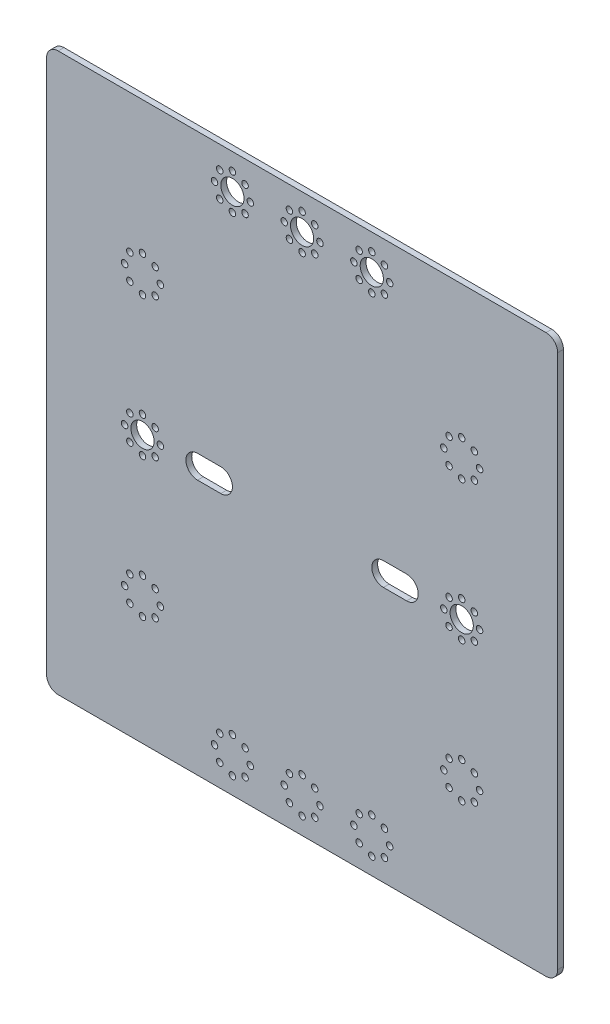
from build123d import *

# Parameters (mm, degrees)
SKETCH1_W                  = 279.4
SKETCH1_H                  = 304.8
BOSS_EXTRUDE1_DEPTH        = 3.175
SKETCH2_R                  = 6.35
CUT_EXTRUDE1_DEPTH         = 3.175
SKETCH3_R                  = 1.778
CUT_EXTRUDE2_DEPTH         = 3.175
CIRPATTERN1_COUNT          = 8
SKETCH4_R                  = 1.778
CUT_EXTRUDE3_DEPTH         = 3.175
CIRPATTERN2_COUNT          = 8
MIRROR1_COPY_1_SKETCH_R    = 1.778
MIRROR1_COPY_1_DEPTH       = 3.175
MIRROR1_COPY_2_SKETCH_R    = 1.778
MIRROR1_COPY_2_DEPTH       = 3.175
MIRROR1_COPY_3_SKETCH_R    = 1.778
MIRROR1_COPY_3_DEPTH       = 3.175
MIRROR1_COPY_4_SKETCH_R    = 1.778
MIRROR1_COPY_4_DEPTH       = 3.175
MIRROR1_COPY_5_SKETCH_R    = 1.778
MIRROR1_COPY_5_DEPTH       = 3.175
MIRROR1_COPY_6_SKETCH_R    = 1.778
MIRROR1_COPY_6_DEPTH       = 3.175
MIRROR1_COPY_7_SKETCH_R    = 1.778
MIRROR1_COPY_7_DEPTH       = 3.175
LPATTERN2_COUNT            = 4
LPATTERN2_PITCH            = 38.1
LPATTERN2_COPY_1_SKETCH_R  = 1.778
LPATTERN2_COPY_1_DEPTH     = 3.175
LPATTERN2_COPY_2_SKETCH_R  = 1.778
LPATTERN2_COPY_2_DEPTH     = 3.175
LPATTERN2_COPY_3_SKETCH_R  = 1.778
LPATTERN2_COPY_3_DEPTH     = 3.175
LPATTERN2_COPY_4_SKETCH_R  = 1.778
LPATTERN2_COPY_4_DEPTH     = 3.175
LPATTERN2_COPY_5_SKETCH_R  = 1.778
LPATTERN2_COPY_5_DEPTH     = 3.175
LPATTERN2_COPY_6_SKETCH_R  = 1.778
LPATTERN2_COPY_6_DEPTH     = 3.175
LPATTERN2_COPY_7_SKETCH_R  = 1.778
LPATTERN2_COPY_7_DEPTH     = 3.175
LPATTERN2_COPY_8_SKETCH_R  = 6.35
LPATTERN2_COPY_8_DEPTH     = 3.175
LPATTERN2_COPY_9_SKETCH_R  = 1.778
LPATTERN2_COPY_9_DEPTH     = 3.175
LPATTERN2_COPY_10_SKETCH_R = 1.778
LPATTERN2_COPY_10_DEPTH    = 3.175
LPATTERN2_COPY_11_SKETCH_R = 1.778
LPATTERN2_COPY_11_DEPTH    = 3.175
LPATTERN2_COPY_12_SKETCH_R = 1.778
LPATTERN2_COPY_12_DEPTH    = 3.175
LPATTERN2_COPY_13_SKETCH_R = 1.778
LPATTERN2_COPY_13_DEPTH    = 3.175
LPATTERN2_COPY_14_SKETCH_R = 1.778
LPATTERN2_COPY_14_DEPTH    = 3.175
LPATTERN2_COPY_15_SKETCH_R = 1.778
LPATTERN2_COPY_15_DEPTH    = 3.175
LPATTERN2_COPY_16_SKETCH_R = 1.778
LPATTERN2_COPY_16_DEPTH    = 3.175
LPATTERN3_COUNT            = 4
LPATTERN3_PITCH            = 38.1
LPATTERN3_COPY_1_SKETCH_R  = 1.778
LPATTERN3_COPY_1_DEPTH     = 3.175
LPATTERN3_COPY_2_SKETCH_R  = 1.778
LPATTERN3_COPY_2_DEPTH     = 3.175
LPATTERN3_COPY_3_SKETCH_R  = 1.778
LPATTERN3_COPY_3_DEPTH     = 3.175
LPATTERN3_COPY_4_SKETCH_R  = 1.778
LPATTERN3_COPY_4_DEPTH     = 3.175
LPATTERN3_COPY_5_SKETCH_R  = 1.778
LPATTERN3_COPY_5_DEPTH     = 3.175
LPATTERN3_COPY_6_SKETCH_R  = 1.778
LPATTERN3_COPY_6_DEPTH     = 3.175
LPATTERN3_COPY_7_SKETCH_R  = 1.778
LPATTERN3_COPY_7_DEPTH     = 3.175
SKETCH5_R                  = 6.35
BOSS_EXTRUDE4_DEPTH        = 3.175
MIRROR4_COPY_1_SKETCH_R    = 1.778
MIRROR4_COPY_1_DEPTH       = 3.175
MIRROR4_COPY_2_SKETCH_R    = 1.778
MIRROR4_COPY_2_DEPTH       = 3.175
MIRROR4_COPY_3_SKETCH_R    = 1.778
MIRROR4_COPY_3_DEPTH       = 3.175
MIRROR4_COPY_4_SKETCH_R    = 1.778
MIRROR4_COPY_4_DEPTH       = 3.175
MIRROR4_COPY_5_SKETCH_R    = 1.778
MIRROR4_COPY_5_DEPTH       = 3.175
MIRROR4_COPY_6_SKETCH_R    = 1.778
MIRROR4_COPY_6_DEPTH       = 3.175
MIRROR4_COPY_7_SKETCH_R    = 1.778
MIRROR4_COPY_7_DEPTH       = 3.175
MIRROR4_COPY_8_SKETCH_R    = 1.778
MIRROR4_COPY_8_DEPTH       = 3.175
MIRROR4_COPY_9_SKETCH_R    = 1.778
MIRROR4_COPY_9_DEPTH       = 3.175
SKETCH6_R                  = 6.35
CUT_EXTRUDE4_DEPTH         = 3.175
SKETCH7_R                  = 1.778
CUT_EXTRUDE5_DEPTH         = 3.175
CIRPATTERN3_COUNT          = 8
SKETCH8_R                  = 1.778
CUT_EXTRUDE6_DEPTH         = 3.175
CIRPATTERN4_COUNT          = 8
MIRROR5_COPY_1_SKETCH_R    = 1.778
MIRROR5_COPY_1_DEPTH       = 3.175
MIRROR5_COPY_2_SKETCH_R    = 1.778
MIRROR5_COPY_2_DEPTH       = 3.175
MIRROR5_COPY_3_SKETCH_R    = 1.778
MIRROR5_COPY_3_DEPTH       = 3.175
MIRROR5_COPY_4_SKETCH_R    = 1.778
MIRROR5_COPY_4_DEPTH       = 3.175
MIRROR5_COPY_5_SKETCH_R    = 1.778
MIRROR5_COPY_5_DEPTH       = 3.175
MIRROR5_COPY_6_SKETCH_R    = 1.778
MIRROR5_COPY_6_DEPTH       = 3.175
MIRROR5_COPY_7_SKETCH_R    = 1.778
MIRROR5_COPY_7_DEPTH       = 3.175
MIRROR5_COPY_8_SKETCH_R    = 1.778
MIRROR5_COPY_8_DEPTH       = 3.175
MIRROR5_COPY_9_SKETCH_R    = 1.778
MIRROR5_COPY_9_DEPTH       = 3.175
MIRROR5_COPY_10_SKETCH_R   = 1.778
MIRROR5_COPY_10_DEPTH      = 3.175
MIRROR5_COPY_11_SKETCH_R   = 1.778
MIRROR5_COPY_11_DEPTH      = 3.175
MIRROR5_COPY_12_SKETCH_R   = 1.778
MIRROR5_COPY_12_DEPTH      = 3.175
MIRROR5_COPY_13_SKETCH_R   = 1.778
MIRROR5_COPY_13_DEPTH      = 3.175
MIRROR5_COPY_14_SKETCH_R   = 1.778
MIRROR5_COPY_14_DEPTH      = 3.175
FILLET1_R                  = 6.35
CUT_EXTRUDE8_DEPTH         = 3.175
MIRROR8_COPY_1_SKETCH_R    = 1.778
MIRROR8_COPY_1_DEPTH       = 3.175
MIRROR8_COPY_2_SKETCH_R    = 1.778
MIRROR8_COPY_2_DEPTH       = 3.175
MIRROR8_COPY_3_SKETCH_R    = 1.778
MIRROR8_COPY_3_DEPTH       = 3.175
MIRROR8_COPY_4_SKETCH_R    = 1.778
MIRROR8_COPY_4_DEPTH       = 3.175
MIRROR8_COPY_5_SKETCH_R    = 1.778
MIRROR8_COPY_5_DEPTH       = 3.175
MIRROR8_COPY_6_SKETCH_R    = 1.778
MIRROR8_COPY_6_DEPTH       = 3.175
MIRROR8_COPY_7_SKETCH_R    = 1.778
MIRROR8_COPY_7_DEPTH       = 3.175


with BuildPart() as part:
    # Sketch1 → Boss-Extrude1 (new body)
    with BuildSketch(Plane.XY):
        with Locations((-139.7, -152.4)):
            Rectangle(SKETCH1_W, SKETCH1_H)
    extrude(amount=BOSS_EXTRUDE1_DEPTH)

    # Sketch2 → Cut-Extrude1 (cut)
    with BuildSketch(Plane.XY.offset(3.175)):
        with Locations((-139.7, -19.05)):
            Circle(SKETCH2_R)
        with Locations((-226.949, -158.75)):
            Circle(SKETCH2_R)
    cut_extrude1 = extrude(amount=-CUT_EXTRUDE1_DEPTH, mode=Mode.SUBTRACT)

    # Sketch3 → Cut-Extrude2 (cut)
    with BuildSketch(Plane.XY.offset(3.175)):
        with Locations((-139.7, -9.271)):
            Circle(SKETCH3_R)
    cut_extrude2 = extrude(amount=-CUT_EXTRUDE2_DEPTH, mode=Mode.SUBTRACT)

    # CirPattern1: Cut-Extrude2 ×8 about axis
    cirpattern1_axis = Axis((-139.7, -19.05, 0), (0, 0, 1))
    for i in range(1, CIRPATTERN1_COUNT):
        add(cut_extrude2.rotate(cirpattern1_axis, i * 360 / CIRPATTERN1_COUNT), mode=Mode.SUBTRACT)

    # Sketch4 → Cut-Extrude3 (cut)
    with BuildSketch(Plane.XY.offset(3.175)):
        with Locations((-226.949, -148.971)):
            Circle(SKETCH4_R)
    cut_extrude3 = extrude(amount=-CUT_EXTRUDE3_DEPTH, mode=Mode.SUBTRACT)

    # CirPattern2: Cut-Extrude3 ×8 about axis
    cirpattern2_axis = Axis((-226.949, -158.75, 0), (0, 0, 1))
    for i in range(1, CIRPATTERN2_COUNT):
        add(cut_extrude3.rotate(cirpattern2_axis, i * 360 / CIRPATTERN2_COUNT), mode=Mode.SUBTRACT)

    # Mirror1: Cut-Extrude1, Cut-Extrude3 across plane
    add(cut_extrude1.mirror(Plane.ZY.offset(139.7)), mode=Mode.SUBTRACT)
    add(cut_extrude3.mirror(Plane.ZY.offset(139.7)), mode=Mode.SUBTRACT)

    # Mirror1 copy 1 sketch → Mirror1 copy 1 (cut)
    with BuildSketch(Plane(origin=(-100.67497537, 113.980378397, 3.175), x_dir=(-0.7071067811865475, 0.7071067811865476, 0), z_dir=(0, 0, 1))):
        with Locations((-226.949, 148.971)):
            Circle(MIRROR1_COPY_1_SKETCH_R)
    extrude(amount=-MIRROR1_COPY_1_DEPTH, mode=Mode.SUBTRACT)

    # Mirror1 copy 2 sketch → Mirror1 copy 2 (cut)
    with BuildSketch(Plane(origin=(106.299, 68.199, 3.175), x_dir=(0, 1, 0), z_dir=(0, 0, 1))):
        with Locations((-226.949, 148.971)):
            Circle(MIRROR1_COPY_2_SKETCH_R)
    extrude(amount=-MIRROR1_COPY_2_DEPTH, mode=Mode.SUBTRACT)

    # Mirror1 copy 3 sketch → Mirror1 copy 3 (cut)
    with BuildSketch(Plane(origin=(220.279378397, -110.52602463, 3.175), x_dir=(0.7071067811865476, 0.7071067811865475, 0), z_dir=(0, 0, 1))):
        with Locations((-226.949, 148.971)):
            Circle(MIRROR1_COPY_3_SKETCH_R)
    extrude(amount=-MIRROR1_COPY_3_DEPTH, mode=Mode.SUBTRACT)

    # Mirror1 copy 4 sketch → Mirror1 copy 4 (cut)
    with BuildSketch(Plane(origin=(174.498, -317.5, 3.175), x_dir=(1, 0, 0), z_dir=(0, 0, 1))):
        with Locations((-226.949, 148.971)):
            Circle(MIRROR1_COPY_4_SKETCH_R)
    extrude(amount=-MIRROR1_COPY_4_DEPTH, mode=Mode.SUBTRACT)

    # Mirror1 copy 5 sketch → Mirror1 copy 5 (cut)
    with BuildSketch(Plane(origin=(-4.22702463, -431.480378397, 3.175), x_dir=(0.7071067811865476, -0.7071067811865476, 0), z_dir=(0, 0, 1))):
        with Locations((-226.949, 148.971)):
            Circle(MIRROR1_COPY_5_SKETCH_R)
    extrude(amount=-MIRROR1_COPY_5_DEPTH, mode=Mode.SUBTRACT)

    # Mirror1 copy 6 sketch → Mirror1 copy 6 (cut)
    with BuildSketch(Plane(origin=(-211.201, -385.699, 3.175), x_dir=(0, -1, 0), z_dir=(0, 0, 1))):
        with Locations((-226.949, 148.971)):
            Circle(MIRROR1_COPY_6_SKETCH_R)
    extrude(amount=-MIRROR1_COPY_6_DEPTH, mode=Mode.SUBTRACT)

    # Mirror1 copy 7 sketch → Mirror1 copy 7 (cut)
    with BuildSketch(Plane(origin=(-325.181378397, -206.97397537, 3.175), x_dir=(-0.7071067811865475, -0.7071067811865476, 0), z_dir=(0, 0, 1))):
        with Locations((-226.949, 148.971)):
            Circle(MIRROR1_COPY_7_SKETCH_R)
    extrude(amount=-MIRROR1_COPY_7_DEPTH, mode=Mode.SUBTRACT)

    # LPattern2: Cut-Extrude1, Cut-Extrude3 ×4, 2 skipped
    with Locations(*[(0, i * LPATTERN2_PITCH, 0) for i in range(1, LPATTERN2_COUNT) if i not in (1, 3)]):
        add(cut_extrude1, mode=Mode.SUBTRACT)
        add(cut_extrude3, mode=Mode.SUBTRACT)

    # LPattern2 copy 1 sketch → LPattern2 copy 1 (cut)
    with BuildSketch(Plane(origin=(-178.72502463, 190.180378397, 3.175), x_dir=(0.7071067811865476, 0.7071067811865475, 0), z_dir=(0, 0, 1))):
        with Locations((-226.949, -148.971)):
            Circle(LPATTERN2_COPY_1_SKETCH_R)
    extrude(amount=-LPATTERN2_COPY_1_DEPTH, mode=Mode.SUBTRACT)

    # LPattern2 copy 2 sketch → LPattern2 copy 2 (cut)
    with BuildSketch(Plane(origin=(-385.699, 144.399, 3.175), x_dir=(0, 1, 0), z_dir=(0, 0, 1))):
        with Locations((-226.949, -148.971)):
            Circle(LPATTERN2_COPY_2_SKETCH_R)
    extrude(amount=-LPATTERN2_COPY_2_DEPTH, mode=Mode.SUBTRACT)

    # LPattern2 copy 3 sketch → LPattern2 copy 3 (cut)
    with BuildSketch(Plane(origin=(-499.679378397, -34.32602463, 3.175), x_dir=(-0.7071067811865475, 0.7071067811865476, 0), z_dir=(0, 0, 1))):
        with Locations((-226.949, -148.971)):
            Circle(LPATTERN2_COPY_3_SKETCH_R)
    extrude(amount=-LPATTERN2_COPY_3_DEPTH, mode=Mode.SUBTRACT)

    # LPattern2 copy 4 sketch → LPattern2 copy 4 (cut)
    with BuildSketch(Plane(origin=(-453.898, -241.3, 3.175), x_dir=(-1, 0, 0), z_dir=(0, 0, 1))):
        with Locations((-226.949, -148.971)):
            Circle(LPATTERN2_COPY_4_SKETCH_R)
    extrude(amount=-LPATTERN2_COPY_4_DEPTH, mode=Mode.SUBTRACT)

    # LPattern2 copy 5 sketch → LPattern2 copy 5 (cut)
    with BuildSketch(Plane(origin=(-275.17297537, -355.280378397, 3.175), x_dir=(-0.7071067811865477, -0.7071067811865475, 0), z_dir=(0, 0, 1))):
        with Locations((-226.949, -148.971)):
            Circle(LPATTERN2_COPY_5_SKETCH_R)
    extrude(amount=-LPATTERN2_COPY_5_DEPTH, mode=Mode.SUBTRACT)

    # LPattern2 copy 6 sketch → LPattern2 copy 6 (cut)
    with BuildSketch(Plane(origin=(-68.199, -309.499, 3.175), x_dir=(0, -1, 0), z_dir=(0, 0, 1))):
        with Locations((-226.949, -148.971)):
            Circle(LPATTERN2_COPY_6_SKETCH_R)
    extrude(amount=-LPATTERN2_COPY_6_DEPTH, mode=Mode.SUBTRACT)

    # LPattern2 copy 7 sketch → LPattern2 copy 7 (cut)
    with BuildSketch(Plane(origin=(45.781378397, -130.77397537, 3.175), x_dir=(0.7071067811865474, -0.7071067811865477, 0), z_dir=(0, 0, 1))):
        with Locations((-226.949, -148.971)):
            Circle(LPATTERN2_COPY_7_SKETCH_R)
    extrude(amount=-LPATTERN2_COPY_7_DEPTH, mode=Mode.SUBTRACT)

    # LPattern2 copy 8 sketch → LPattern2 copy 8 (cut)
    with BuildSketch(Plane(origin=(-279.4, 76.2, 3.175), x_dir=(-1, 0, 0), z_dir=(0, 0, 1))):
        with Locations((-139.7, 19.05)):
            Circle(LPATTERN2_COPY_8_SKETCH_R)
        with Locations((-226.949, 158.75)):
            Circle(LPATTERN2_COPY_8_SKETCH_R)
    extrude(amount=-LPATTERN2_COPY_8_DEPTH, mode=Mode.SUBTRACT)

    # LPattern2 copy 9 sketch → LPattern2 copy 9 (cut)
    with BuildSketch(Plane(origin=(-279.4, 76.2, 3.175), x_dir=(-1, 0, 0), z_dir=(0, 0, 1))):
        with Locations((-226.949, 148.971)):
            Circle(LPATTERN2_COPY_9_SKETCH_R)
    extrude(amount=-LPATTERN2_COPY_9_DEPTH, mode=Mode.SUBTRACT)

    # LPattern2 copy 10 sketch → LPattern2 copy 10 (cut)
    with BuildSketch(Plane(origin=(-100.67497537, 190.180378397, 3.175), x_dir=(-0.7071067811865475, 0.7071067811865476, 0), z_dir=(0, 0, 1))):
        with Locations((-226.949, 148.971)):
            Circle(LPATTERN2_COPY_10_SKETCH_R)
    extrude(amount=-LPATTERN2_COPY_10_DEPTH, mode=Mode.SUBTRACT)

    # LPattern2 copy 11 sketch → LPattern2 copy 11 (cut)
    with BuildSketch(Plane(origin=(106.299, 144.399, 3.175), x_dir=(0, 1, 0), z_dir=(0, 0, 1))):
        with Locations((-226.949, 148.971)):
            Circle(LPATTERN2_COPY_11_SKETCH_R)
    extrude(amount=-LPATTERN2_COPY_11_DEPTH, mode=Mode.SUBTRACT)

    # LPattern2 copy 12 sketch → LPattern2 copy 12 (cut)
    with BuildSketch(Plane(origin=(220.279378397, -34.32602463, 3.175), x_dir=(0.7071067811865476, 0.7071067811865475, 0), z_dir=(0, 0, 1))):
        with Locations((-226.949, 148.971)):
            Circle(LPATTERN2_COPY_12_SKETCH_R)
    extrude(amount=-LPATTERN2_COPY_12_DEPTH, mode=Mode.SUBTRACT)

    # LPattern2 copy 13 sketch → LPattern2 copy 13 (cut)
    with BuildSketch(Plane(origin=(174.498, -241.3, 3.175), x_dir=(1, 0, 0), z_dir=(0, 0, 1))):
        with Locations((-226.949, 148.971)):
            Circle(LPATTERN2_COPY_13_SKETCH_R)
    extrude(amount=-LPATTERN2_COPY_13_DEPTH, mode=Mode.SUBTRACT)

    # LPattern2 copy 14 sketch → LPattern2 copy 14 (cut)
    with BuildSketch(Plane(origin=(-4.22702463, -355.280378397, 3.175), x_dir=(0.7071067811865476, -0.7071067811865476, 0), z_dir=(0, 0, 1))):
        with Locations((-226.949, 148.971)):
            Circle(LPATTERN2_COPY_14_SKETCH_R)
    extrude(amount=-LPATTERN2_COPY_14_DEPTH, mode=Mode.SUBTRACT)

    # LPattern2 copy 15 sketch → LPattern2 copy 15 (cut)
    with BuildSketch(Plane(origin=(-211.201, -309.499, 3.175), x_dir=(0, -1, 0), z_dir=(0, 0, 1))):
        with Locations((-226.949, 148.971)):
            Circle(LPATTERN2_COPY_15_SKETCH_R)
    extrude(amount=-LPATTERN2_COPY_15_DEPTH, mode=Mode.SUBTRACT)

    # LPattern2 copy 16 sketch → LPattern2 copy 16 (cut)
    with BuildSketch(Plane(origin=(-325.181378397, -130.77397537, 3.175), x_dir=(-0.7071067811865475, -0.7071067811865476, 0), z_dir=(0, 0, 1))):
        with Locations((-226.949, 148.971)):
            Circle(LPATTERN2_COPY_16_SKETCH_R)
    extrude(amount=-LPATTERN2_COPY_16_DEPTH, mode=Mode.SUBTRACT)

    # LPattern3: Cut-Extrude3 ×4, 2 skipped
    with Locations(*[(0, -i * LPATTERN3_PITCH, 0) for i in range(1, LPATTERN3_COUNT) if i not in (1, 3)]):
        add(cut_extrude3, mode=Mode.SUBTRACT)

    # LPattern3 copy 1 sketch → LPattern3 copy 1 (cut)
    with BuildSketch(Plane(origin=(-178.72502463, 37.780378397, 3.175), x_dir=(0.7071067811865476, 0.7071067811865475, 0), z_dir=(0, 0, 1))):
        with Locations((-226.949, -148.971)):
            Circle(LPATTERN3_COPY_1_SKETCH_R)
    extrude(amount=-LPATTERN3_COPY_1_DEPTH, mode=Mode.SUBTRACT)

    # LPattern3 copy 2 sketch → LPattern3 copy 2 (cut)
    with BuildSketch(Plane(origin=(-385.699, -8.001, 3.175), x_dir=(0, 1, 0), z_dir=(0, 0, 1))):
        with Locations((-226.949, -148.971)):
            Circle(LPATTERN3_COPY_2_SKETCH_R)
    extrude(amount=-LPATTERN3_COPY_2_DEPTH, mode=Mode.SUBTRACT)

    # LPattern3 copy 3 sketch → LPattern3 copy 3 (cut)
    with BuildSketch(Plane(origin=(-499.679378397, -186.72602463, 3.175), x_dir=(-0.7071067811865475, 0.7071067811865476, 0), z_dir=(0, 0, 1))):
        with Locations((-226.949, -148.971)):
            Circle(LPATTERN3_COPY_3_SKETCH_R)
    extrude(amount=-LPATTERN3_COPY_3_DEPTH, mode=Mode.SUBTRACT)

    # LPattern3 copy 4 sketch → LPattern3 copy 4 (cut)
    with BuildSketch(Plane(origin=(-453.898, -393.7, 3.175), x_dir=(-1, 0, 0), z_dir=(0, 0, 1))):
        with Locations((-226.949, -148.971)):
            Circle(LPATTERN3_COPY_4_SKETCH_R)
    extrude(amount=-LPATTERN3_COPY_4_DEPTH, mode=Mode.SUBTRACT)

    # LPattern3 copy 5 sketch → LPattern3 copy 5 (cut)
    with BuildSketch(Plane(origin=(-275.17297537, -507.680378397, 3.175), x_dir=(-0.7071067811865477, -0.7071067811865475, 0), z_dir=(0, 0, 1))):
        with Locations((-226.949, -148.971)):
            Circle(LPATTERN3_COPY_5_SKETCH_R)
    extrude(amount=-LPATTERN3_COPY_5_DEPTH, mode=Mode.SUBTRACT)

    # LPattern3 copy 6 sketch → LPattern3 copy 6 (cut)
    with BuildSketch(Plane(origin=(-68.199, -461.899, 3.175), x_dir=(0, -1, 0), z_dir=(0, 0, 1))):
        with Locations((-226.949, -148.971)):
            Circle(LPATTERN3_COPY_6_SKETCH_R)
    extrude(amount=-LPATTERN3_COPY_6_DEPTH, mode=Mode.SUBTRACT)

    # LPattern3 copy 7 sketch → LPattern3 copy 7 (cut)
    with BuildSketch(Plane(origin=(45.781378397, -283.17397537, 3.175), x_dir=(0.7071067811865474, -0.7071067811865477, 0), z_dir=(0, 0, 1))):
        with Locations((-226.949, -148.971)):
            Circle(LPATTERN3_COPY_7_SKETCH_R)
    extrude(amount=-LPATTERN3_COPY_7_DEPTH, mode=Mode.SUBTRACT)

    # Sketch5 → Boss-Extrude4 (add)
    with BuildSketch(Plane.XY.offset(3.175)):
        with Locations((-226.949, -82.55)):
            Circle(SKETCH5_R)
        with Locations((-52.451, -82.55)):
            Circle(SKETCH5_R)
    extrude(amount=-BOSS_EXTRUDE4_DEPTH)

    # Mirror4 copy 1 sketch → Mirror4 copy 1 (cut)
    with BuildSketch(Plane(origin=(-279.4, -76.2, 3.175), x_dir=(-1, 0, 0), z_dir=(0, 0, 1))):
        with Locations((-226.949, 148.971)):
            Circle(MIRROR4_COPY_1_SKETCH_R)
    extrude(amount=-MIRROR4_COPY_1_DEPTH, mode=Mode.SUBTRACT)

    # Mirror4 copy 2 sketch → Mirror4 copy 2 (cut)
    with BuildSketch(Plane(origin=(-100.67497537, 37.780378397, 3.175), x_dir=(-0.7071067811865475, 0.7071067811865476, 0), z_dir=(0, 0, 1))):
        with Locations((-226.949, 148.971)):
            Circle(MIRROR4_COPY_2_SKETCH_R)
    extrude(amount=-MIRROR4_COPY_2_DEPTH, mode=Mode.SUBTRACT)

    # Mirror4 copy 3 sketch → Mirror4 copy 3 (cut)
    with BuildSketch(Plane(origin=(106.299, -8.001, 3.175), x_dir=(0, 1, 0), z_dir=(0, 0, 1))):
        with Locations((-226.949, 148.971)):
            Circle(MIRROR4_COPY_3_SKETCH_R)
    extrude(amount=-MIRROR4_COPY_3_DEPTH, mode=Mode.SUBTRACT)

    # Mirror4 copy 4 sketch → Mirror4 copy 4 (cut)
    with BuildSketch(Plane(origin=(220.279378397, -186.72602463, 3.175), x_dir=(0.7071067811865476, 0.7071067811865475, 0), z_dir=(0, 0, 1))):
        with Locations((-226.949, 148.971)):
            Circle(MIRROR4_COPY_4_SKETCH_R)
    extrude(amount=-MIRROR4_COPY_4_DEPTH, mode=Mode.SUBTRACT)

    # Mirror4 copy 5 sketch → Mirror4 copy 5 (cut)
    with BuildSketch(Plane(origin=(174.498, -393.7, 3.175), x_dir=(1, 0, 0), z_dir=(0, 0, 1))):
        with Locations((-226.949, 148.971)):
            Circle(MIRROR4_COPY_5_SKETCH_R)
    extrude(amount=-MIRROR4_COPY_5_DEPTH, mode=Mode.SUBTRACT)

    # Mirror4 copy 6 sketch → Mirror4 copy 6 (cut)
    with BuildSketch(Plane(origin=(-4.22702463, -507.680378397, 3.175), x_dir=(0.7071067811865476, -0.7071067811865476, 0), z_dir=(0, 0, 1))):
        with Locations((-226.949, 148.971)):
            Circle(MIRROR4_COPY_6_SKETCH_R)
    extrude(amount=-MIRROR4_COPY_6_DEPTH, mode=Mode.SUBTRACT)

    # Mirror4 copy 7 sketch → Mirror4 copy 7 (cut)
    with BuildSketch(Plane(origin=(-211.201, -461.899, 3.175), x_dir=(0, -1, 0), z_dir=(0, 0, 1))):
        with Locations((-226.949, 148.971)):
            Circle(MIRROR4_COPY_7_SKETCH_R)
    extrude(amount=-MIRROR4_COPY_7_DEPTH, mode=Mode.SUBTRACT)

    # Mirror4 copy 8 sketch → Mirror4 copy 8 (cut)
    with BuildSketch(Plane(origin=(-325.181378397, -283.17397537, 3.175), x_dir=(-0.7071067811865475, -0.7071067811865476, 0), z_dir=(0, 0, 1))):
        with Locations((-226.949, 148.971)):
            Circle(MIRROR4_COPY_8_SKETCH_R)
    extrude(amount=-MIRROR4_COPY_8_DEPTH, mode=Mode.SUBTRACT)

    # Mirror4 copy 9 sketch → Mirror4 copy 9 (cut)
    with BuildSketch(Plane(origin=(-279.4, 0, 3.175), x_dir=(-1, 0, 0), z_dir=(0, 0, 1))):
        with Locations((-226.949, 148.971)):
            Circle(MIRROR4_COPY_9_SKETCH_R)
    extrude(amount=-MIRROR4_COPY_9_DEPTH, mode=Mode.SUBTRACT)

    # Sketch6 → Cut-Extrude4 (cut)
    with BuildSketch(Plane.XY.offset(3.175)):
        with Locations((-101.6, -19.05)):
            Circle(SKETCH6_R)
        with Locations((-177.8, -19.05)):
            Circle(SKETCH6_R)
    extrude(amount=-CUT_EXTRUDE4_DEPTH, mode=Mode.SUBTRACT)

    # Sketch7 → Cut-Extrude5 (cut)
    with BuildSketch(Plane.XY.offset(3.175)):
        with Locations((-177.8, -9.271)):
            Circle(SKETCH7_R)
    cut_extrude5 = extrude(amount=-CUT_EXTRUDE5_DEPTH, mode=Mode.SUBTRACT)

    # CirPattern3: Cut-Extrude5 ×8 about axis
    cirpattern3_axis = Axis((-177.8, -19.05, 0), (0, 0, 1))
    for i in range(1, CIRPATTERN3_COUNT):
        add(cut_extrude5.rotate(cirpattern3_axis, i * 360 / CIRPATTERN3_COUNT), mode=Mode.SUBTRACT)

    # Sketch8 → Cut-Extrude6 (cut)
    with BuildSketch(Plane.XY.offset(3.175)):
        with Locations((-101.6, -9.271)):
            Circle(SKETCH8_R)
    cut_extrude6 = extrude(amount=-CUT_EXTRUDE6_DEPTH, mode=Mode.SUBTRACT)

    # CirPattern4: Cut-Extrude6 ×8 about axis
    cirpattern4_axis = Axis((-101.6, -19.05, 0), (0, 0, 1))
    for i in range(1, CIRPATTERN4_COUNT):
        add(cut_extrude6.rotate(cirpattern4_axis, i * 360 / CIRPATTERN4_COUNT), mode=Mode.SUBTRACT)

    # Mirror5: Cut-Extrude5, Cut-Extrude6 across plane
    add(cut_extrude5.mirror(Plane.ZX.offset(-152.4)), mode=Mode.SUBTRACT)
    add(cut_extrude6.mirror(Plane.ZX.offset(-152.4)), mode=Mode.SUBTRACT)

    # Mirror5 copy 1 sketch → Mirror5 copy 1 (cut)
    with BuildSketch(Plane(origin=(-65.546798487, -424.943969877, 3.175), x_dir=(0.7071067811865478, -0.7071067811865472, 0), z_dir=(0, 0, 1))):
        with Locations((-177.8, 9.271)):
            Circle(MIRROR5_COPY_1_SKETCH_R)
    extrude(amount=-MIRROR5_COPY_1_DEPTH, mode=Mode.SUBTRACT)

    # Mirror5 copy 2 sketch → Mirror5 copy 2 (cut)
    with BuildSketch(Plane(origin=(-196.85, -463.55, 3.175), x_dir=(0, -1, 0), z_dir=(0, 0, 1))):
        with Locations((-177.8, 9.271)):
            Circle(MIRROR5_COPY_2_SKETCH_R)
    extrude(amount=-MIRROR5_COPY_2_DEPTH, mode=Mode.SUBTRACT)

    # Mirror5 copy 3 sketch → Mirror5 copy 3 (cut)
    with BuildSketch(Plane(origin=(-316.993969877, -398.003201513, 3.175), x_dir=(-0.7071067811865472, -0.7071067811865478, 0), z_dir=(0, 0, 1))):
        with Locations((-177.8, 9.271)):
            Circle(MIRROR5_COPY_3_SKETCH_R)
    extrude(amount=-MIRROR5_COPY_3_DEPTH, mode=Mode.SUBTRACT)

    # Mirror5 copy 4 sketch → Mirror5 copy 4 (cut)
    with BuildSketch(Plane(origin=(-355.6, -266.7, 3.175), x_dir=(-1, 0, 0), z_dir=(0, 0, 1))):
        with Locations((-177.8, 9.271)):
            Circle(MIRROR5_COPY_4_SKETCH_R)
    extrude(amount=-MIRROR5_COPY_4_DEPTH, mode=Mode.SUBTRACT)

    # Mirror5 copy 5 sketch → Mirror5 copy 5 (cut)
    with BuildSketch(Plane(origin=(-290.053201513, -146.556030123, 3.175), x_dir=(-0.7071067811865479, 0.7071067811865472, 0), z_dir=(0, 0, 1))):
        with Locations((-177.8, 9.271)):
            Circle(MIRROR5_COPY_5_SKETCH_R)
    extrude(amount=-MIRROR5_COPY_5_DEPTH, mode=Mode.SUBTRACT)

    # Mirror5 copy 6 sketch → Mirror5 copy 6 (cut)
    with BuildSketch(Plane(origin=(-158.75, -107.95, 3.175), x_dir=(0, 1, 0), z_dir=(0, 0, 1))):
        with Locations((-177.8, 9.271)):
            Circle(MIRROR5_COPY_6_SKETCH_R)
    extrude(amount=-MIRROR5_COPY_6_DEPTH, mode=Mode.SUBTRACT)

    # Mirror5 copy 7 sketch → Mirror5 copy 7 (cut)
    with BuildSketch(Plane(origin=(-38.606030123, -173.496798487, 3.175), x_dir=(0.7071067811865471, 0.7071067811865479, 0), z_dir=(0, 0, 1))):
        with Locations((-177.8, 9.271)):
            Circle(MIRROR5_COPY_7_SKETCH_R)
    extrude(amount=-MIRROR5_COPY_7_DEPTH, mode=Mode.SUBTRACT)

    # Mirror5 copy 8 sketch → Mirror5 copy 8 (cut)
    with BuildSketch(Plane(origin=(-43.228335213, -371.06243315, 3.175), x_dir=(0.7071067811865478, -0.7071067811865472, 0), z_dir=(0, 0, 1))):
        with Locations((-101.6, 9.271)):
            Circle(MIRROR5_COPY_8_SKETCH_R)
    extrude(amount=-MIRROR5_COPY_8_DEPTH, mode=Mode.SUBTRACT)

    # Mirror5 copy 9 sketch → Mirror5 copy 9 (cut)
    with BuildSketch(Plane(origin=(-120.65, -387.35, 3.175), x_dir=(0, -1, 0), z_dir=(0, 0, 1))):
        with Locations((-101.6, 9.271)):
            Circle(MIRROR5_COPY_9_SKETCH_R)
    extrude(amount=-MIRROR5_COPY_9_DEPTH, mode=Mode.SUBTRACT)

    # Mirror5 copy 10 sketch → Mirror5 copy 10 (cut)
    with BuildSketch(Plane(origin=(-186.91243315, -344.121664787, 3.175), x_dir=(-0.7071067811865472, -0.7071067811865478, 0), z_dir=(0, 0, 1))):
        with Locations((-101.6, 9.271)):
            Circle(MIRROR5_COPY_10_SKETCH_R)
    extrude(amount=-MIRROR5_COPY_10_DEPTH, mode=Mode.SUBTRACT)

    # Mirror5 copy 11 sketch → Mirror5 copy 11 (cut)
    with BuildSketch(Plane(origin=(-203.2, -266.7, 3.175), x_dir=(-1, 0, 0), z_dir=(0, 0, 1))):
        with Locations((-101.6, 9.271)):
            Circle(MIRROR5_COPY_11_SKETCH_R)
    extrude(amount=-MIRROR5_COPY_11_DEPTH, mode=Mode.SUBTRACT)

    # Mirror5 copy 12 sketch → Mirror5 copy 12 (cut)
    with BuildSketch(Plane(origin=(-159.971664787, -200.43756685, 3.175), x_dir=(-0.7071067811865479, 0.7071067811865472, 0), z_dir=(0, 0, 1))):
        with Locations((-101.6, 9.271)):
            Circle(MIRROR5_COPY_12_SKETCH_R)
    extrude(amount=-MIRROR5_COPY_12_DEPTH, mode=Mode.SUBTRACT)

    # Mirror5 copy 13 sketch → Mirror5 copy 13 (cut)
    with BuildSketch(Plane(origin=(-82.55, -184.15, 3.175), x_dir=(0, 1, 0), z_dir=(0, 0, 1))):
        with Locations((-101.6, 9.271)):
            Circle(MIRROR5_COPY_13_SKETCH_R)
    extrude(amount=-MIRROR5_COPY_13_DEPTH, mode=Mode.SUBTRACT)

    # Mirror5 copy 14 sketch → Mirror5 copy 14 (cut)
    with BuildSketch(Plane(origin=(-16.28756685, -227.378335213, 3.175), x_dir=(0.7071067811865471, 0.7071067811865479, 0), z_dir=(0, 0, 1))):
        with Locations((-101.6, 9.271)):
            Circle(MIRROR5_COPY_14_SKETCH_R)
    extrude(amount=-MIRROR5_COPY_14_DEPTH, mode=Mode.SUBTRACT)

    # Fillet1
    fillet1_edges = [part.edges().sort_by_distance(p)[0] for p in [
        (0, -304.8, 1.5875),
        (-279.4, -304.8, 1.5875),
        (-279.4, 0, 1.5875),
        (0, 0, 1.5875),
    ]]
    fillet(fillet1_edges, radius=FILLET1_R)

    # Sketch10 → Cut-Extrude8 (cut)
    with BuildSketch(Plane.XY.offset(3.175)):
        with BuildLine():
            Line((-196.85, -152.4), (-184.15, -152.4))
            ThreePointArc((-184.15, -152.4), (-177.8, -158.75), (-184.15, -165.1))
            Line((-184.15, -165.1), (-196.85, -165.1))
            ThreePointArc((-196.85, -165.1), (-203.2, -158.75), (-196.85, -152.4))
        make_face()
    cut_extrude8 = extrude(amount=-CUT_EXTRUDE8_DEPTH, mode=Mode.SUBTRACT)

    # Mirror7: Cut-Extrude8 across plane
    add(cut_extrude8.mirror(Plane.ZY.offset(139.7)), mode=Mode.SUBTRACT)

    # Mirror8: Cut-Extrude2 across plane
    add(cut_extrude2.mirror(Plane.ZX.offset(-152.4)), mode=Mode.SUBTRACT)

    # Mirror8 copy 1 sketch → Mirror8 copy 1 (cut)
    with BuildSketch(Plane(origin=(-54.38756685, -398.003201513, 3.175), x_dir=(0.7071067811865478, -0.7071067811865472, 0), z_dir=(0, 0, 1))):
        with Locations((-139.7, 9.271)):
            Circle(MIRROR8_COPY_1_SKETCH_R)
    extrude(amount=-MIRROR8_COPY_1_DEPTH, mode=Mode.SUBTRACT)

    # Mirror8 copy 2 sketch → Mirror8 copy 2 (cut)
    with BuildSketch(Plane(origin=(-158.75, -425.45, 3.175), x_dir=(0, -1, 0), z_dir=(0, 0, 1))):
        with Locations((-139.7, 9.271)):
            Circle(MIRROR8_COPY_2_SKETCH_R)
    extrude(amount=-MIRROR8_COPY_2_DEPTH, mode=Mode.SUBTRACT)

    # Mirror8 copy 3 sketch → Mirror8 copy 3 (cut)
    with BuildSketch(Plane(origin=(-251.953201513, -371.06243315, 3.175), x_dir=(-0.7071067811865472, -0.7071067811865478, 0), z_dir=(0, 0, 1))):
        with Locations((-139.7, 9.271)):
            Circle(MIRROR8_COPY_3_SKETCH_R)
    extrude(amount=-MIRROR8_COPY_3_DEPTH, mode=Mode.SUBTRACT)

    # Mirror8 copy 4 sketch → Mirror8 copy 4 (cut)
    with BuildSketch(Plane(origin=(-279.4, -266.7, 3.175), x_dir=(-1, 0, 0), z_dir=(0, 0, 1))):
        with Locations((-139.7, 9.271)):
            Circle(MIRROR8_COPY_4_SKETCH_R)
    extrude(amount=-MIRROR8_COPY_4_DEPTH, mode=Mode.SUBTRACT)

    # Mirror8 copy 5 sketch → Mirror8 copy 5 (cut)
    with BuildSketch(Plane(origin=(-225.01243315, -173.496798487, 3.175), x_dir=(-0.7071067811865479, 0.7071067811865472, 0), z_dir=(0, 0, 1))):
        with Locations((-139.7, 9.271)):
            Circle(MIRROR8_COPY_5_SKETCH_R)
    extrude(amount=-MIRROR8_COPY_5_DEPTH, mode=Mode.SUBTRACT)

    # Mirror8 copy 6 sketch → Mirror8 copy 6 (cut)
    with BuildSketch(Plane(origin=(-120.65, -146.05, 3.175), x_dir=(0, 1, 0), z_dir=(0, 0, 1))):
        with Locations((-139.7, 9.271)):
            Circle(MIRROR8_COPY_6_SKETCH_R)
    extrude(amount=-MIRROR8_COPY_6_DEPTH, mode=Mode.SUBTRACT)

    # Mirror8 copy 7 sketch → Mirror8 copy 7 (cut)
    with BuildSketch(Plane(origin=(-27.446798487, -200.43756685, 3.175), x_dir=(0.7071067811865471, 0.7071067811865479, 0), z_dir=(0, 0, 1))):
        with Locations((-139.7, 9.271)):
            Circle(MIRROR8_COPY_7_SKETCH_R)
    extrude(amount=-MIRROR8_COPY_7_DEPTH, mode=Mode.SUBTRACT)


solid = part.part
